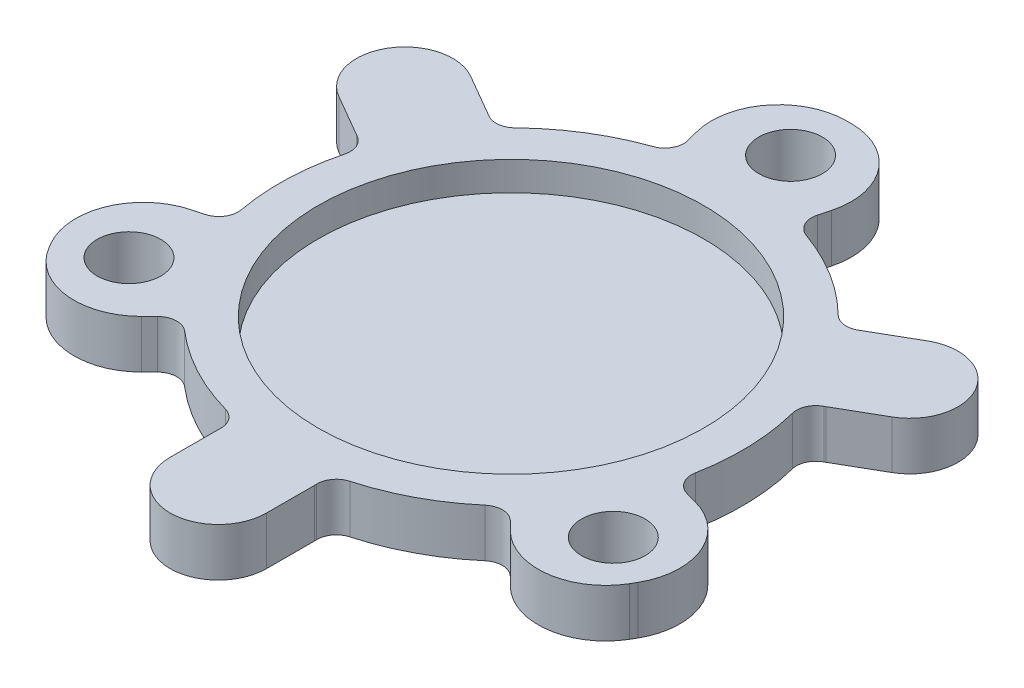
from build123d import *

# Parameters (mm, degrees)
SKETCH1_R           = 20
BOSS_EXTRUDE1_DEPTH = 2
SKETCH2_R           = 35
SKETCH2_R_2         = 20
SKETCH2_R_3         = 3.3
BOSS_EXTRUDE2_DEPTH = 5
CUT_EXTRUDE1_DEPTH  = 10
FILLET1_R           = 2
FILLET2_R           = 7
BOSS_EXTRUDE3_DEPTH = 5
FILLET3_R           = 2


with BuildPart() as part:
    # Sketch1 → Boss-Extrude1 (new body)
    with BuildSketch(Plane(origin=(0, 0, 0), x_dir=(1, 0, 0), z_dir=(0, 1, 0))):
        with Locations(Location((0, 0, 0), (0, 0, 270))):
            Circle(SKETCH1_R)
    extrude(amount=BOSS_EXTRUDE1_DEPTH)

    # Sketch2 → Boss-Extrude2 (add)
    with BuildSketch(Plane(origin=(0, 0, 0), x_dir=(1, 0, 0), z_dir=(0, 1, 0))):
        with Locations(Location((0, 0, 0), (0, 0, 270))):
            Circle(SKETCH2_R)
        with Locations(Location((0, 0, 0), (0, 0, 270))):
            Circle(SKETCH2_R_2, mode=Mode.SUBTRACT)
        with Locations(Location((0, 29, 0), (0, 0, 270))):
            Circle(SKETCH2_R_3, mode=Mode.SUBTRACT)
        with Locations(Location((25.11473671, -14.5, 0), (0, 0, 270))):
            Circle(SKETCH2_R_3, mode=Mode.SUBTRACT)
        with Locations(Location((-25.11473671, -14.5, 0), (0, 0, 270))):
            Circle(SKETCH2_R_3, mode=Mode.SUBTRACT)
    extrude(amount=BOSS_EXTRUDE2_DEPTH)

    # Sketch3 → Cut-Extrude1 (cut)
    with BuildSketch(Plane(origin=(0, 5, 0), x_dir=(1, 0, 0), z_dir=(0, 1, 0))):
        with BuildLine():
            ThreePointArc((-23.193270109, -6.170269172), (-20.763157745, 12.037079399), (-6.170269172, 23.193270109))
            Line((-6.170269172, 23.193270109), (-14.951119735, 56.199389167))
            Line((-14.951119735, 56.199389167), (-49.377364183, -13.136208329))
            Line((-49.377364183, -13.136208329), (-23.193270109, -6.170269172))
        make_face()
        with BuildLine():
            Line((13.312391969, 49.330155919), (6.253025204, 23.171095697))
            ThreePointArc((6.253025204, 23.171095697), (20.805995419, 11.96288237), (23.171095697, -6.253025204))
            Line((23.171095697, -6.253025204), (56.145658563, -15.151645078))
            Line((56.145658563, -15.151645078), (13.312391969, 49.330155919))
        make_face()
        with BuildLine():
            Line((36.064972214, -36.193947589), (16.940244905, -17.000826525))
            ThreePointArc((16.940244905, -17.000826525), (-0.042837674, -23.999961769), (-17.000826525, -16.940244905))
            Line((-17.000826525, -16.940244905), (-41.194538828, -41.047744089))
            Line((-41.194538828, -41.047744089), (36.064972214, -36.193947589))
        make_face()
    extrude(amount=-CUT_EXTRUDE1_DEPTH, mode=Mode.SUBTRACT)

    # Fillet1
    fillet1_edges = [part.edges().sort_by_distance(p)[0] for p in [
        (16.940244905, 2.5, 17.000826525),
        (-17.000826525, 2.5, 16.940244905),
        (6.253025204, 2.5, -23.171095697),
        (23.171095697, 2.5, 6.253025204),
        (-6.170269172, 2.5, -23.193270109),
        (-23.193270109, 2.5, 6.170269172),
    ]]
    fillet(fillet1_edges, radius=FILLET1_R)

    # Fillet2
    fillet2_edges = [part.edges().sort_by_distance(p)[0] for p in [
        (-24.792872016, 2.5, 24.70452382),
        (24.70452382, 2.5, 24.792872016),
        (33.791181225, 2.5, 9.118995089),
        (9.118995089, 2.5, -33.791181225),
        (-8.998309209, 2.5, -33.823518909),
        (-33.823518909, 2.5, 8.998309209),
    ]]
    fillet(fillet2_edges, radius=FILLET2_R)

    # Sketch4 → Boss-Extrude3 (add)
    with BuildSketch(Plane(origin=(0, 5, 0), x_dir=(1, 0, 0), z_dir=(0, 1, 0))):
        with BuildLine():
            Line((-23.70496499, 19.52200868), (-19.379307126, 17.014283806))
            ThreePointArc((-19.379307126, 17.014283806), (-17.561374138, 10.180901067), (-24.394756876, 8.362968079))
            Line((-24.394756876, 8.362968079), (-28.720414739, 10.870692953))
            ThreePointArc((-28.720414739, 10.870692953), (-30.538347728, 17.704075692), (-23.70496499, 19.52200868))
        make_face()
        with BuildLine():
            Line((23.774503624, 19.437262295), (19.439921245, 16.944995134))
            ThreePointArc((19.439921245, 16.944995134), (17.597606027, 10.118145595), (24.424455566, 8.275830376))
            Line((24.424455566, 8.275830376), (28.759037945, 10.768097537))
            ThreePointArc((28.759037945, 10.768097537), (30.601353164, 17.594947076), (23.774503624, 19.437262295))
        make_face()
        with BuildLine():
            Line((4.945911115, -30.307955248), (4.954835631, -25.307963213))
            ThreePointArc((4.954835631, -25.307963213), (-0.036231889, -20.299046662), (-5.04514844, -25.290114182))
            Line((-5.04514844, -25.290114182), (-5.054072955, -30.290106217))
            ThreePointArc((-5.054072955, -30.290106217), (-0.063005435, -35.299022768), (4.945911115, -30.307955248))
        make_face()
    extrude(amount=-BOSS_EXTRUDE3_DEPTH)

    # Fillet3
    fillet3_edges = [part.edges().sort_by_distance(p)[0] for p in [
        (-18.017295098, 2.5, -15.854875507),
        (-22.711825842, 2.5, -7.757123623),
        (22.739372512, 2.5, -7.675997509),
        (18.073779039, 2.5, -15.790456334),
        (-4.722077413, 2.5, 23.530873016),
        (4.638046803, 2.5, 23.547579957),
    ]]
    fillet(fillet3_edges, radius=FILLET3_R)


solid = part.part
